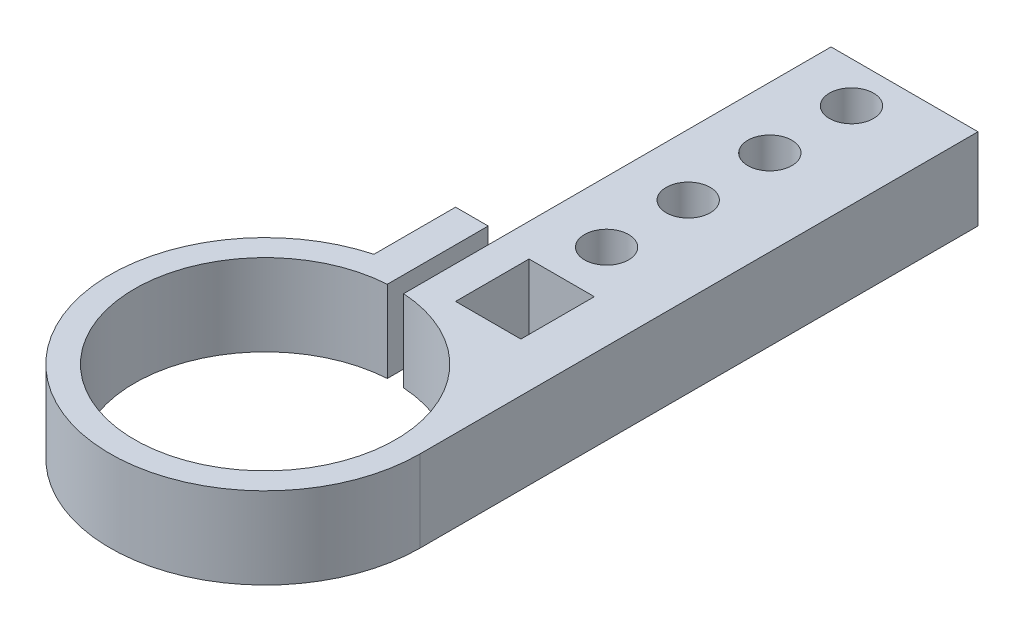
from build123d import *

# Parameters (mm, degrees)
SKETCH1_R           = 24.13
SKETCH1_R_2         = 20.32
BOSS_EXTRUDE1_DEPTH = 12.7
SKETCH2_W           = 12.7
SKETCH2_H           = 12.7
BOSS_EXTRUDE2_DEPTH = 12.7
SKETCH4_W           = 2.54
SKETCH4_H           = 58.988343485
CUT_EXTRUDE2_DEPTH  = 46.144990941
BOSS_EXTRUDE3_REACH = 68.615
BOSS_EXTRUDE3_START = 17.78
SKETCH5_W           = 35.97948453
SKETCH5_H           = 12.7
SKETCH6_W           = 22.86
SKETCH6_H           = 50.8
BOSS_EXTRUDE4_DEPTH = 12.7
SKETCH7_R           = 3.429
SKETCH7_W           = 10.16
SKETCH7_H           = 11.43
CUT_EXTRUDE3_DEPTH  = 91.9627717


with BuildPart() as part:
    # Sketch1 → Boss-Extrude1 (new body)
    with BuildSketch(Plane(origin=(0, 0, 0), x_dir=(1, 0, 0), z_dir=(0, 1, 0))):
        with Locations(Location((0, 0, 0), (0, 0, 270))):
            Circle(SKETCH1_R)
        with Locations(Location((0, 0, 0), (0, 0, 270))):
            Circle(SKETCH1_R_2, mode=Mode.SUBTRACT)
    extrude(amount=BOSS_EXTRUDE1_DEPTH)

    # Sketch2 → Boss-Extrude2 (add)
    with BuildSketch(Plane(origin=(0, 0, 0), x_dir=(1, 0, 0), z_dir=(0, 1, 0))):
        with Locations((0, 29.62948453)):
            Rectangle(SKETCH2_W, SKETCH2_H)
    extrude(amount=BOSS_EXTRUDE2_DEPTH)

    # Sketch4 → Cut-Extrude2 (cut, through all)
    with BuildSketch(Plane(origin=(0, 0, 0), x_dir=(1, 0, 0), z_dir=(0, 1, 0))):
        with Locations((0, 30.925816426)):
            Rectangle(SKETCH4_W, SKETCH4_H)
    extrude(amount=CUT_EXTRUDE2_DEPTH, mode=Mode.SUBTRACT)

    # Sketch5 → Boss-Extrude3 (add, up to next)
    with BuildSketch(Plane(origin=(6.35, 0, 0), x_dir=(0, 0, -1), z_dir=(1, 0, 0)).offset(BOSS_EXTRUDE3_START), mode=Mode.PRIVATE) as boss_extrude3_sk1:
        with Locations((17.989742265, 6.35)):
            Rectangle(SKETCH5_W, SKETCH5_H)
    boss_extrude3_tool1 = extrude(boss_extrude3_sk1.sketch, amount=-BOSS_EXTRUDE3_REACH, mode=Mode.PRIVATE) - part.part
    add(boss_extrude3_tool1.solids().sort_by_distance((24.13, 6.35, -17.989742))[0])

    # Sketch6 → Boss-Extrude4 (add)
    with BuildSketch(Plane(origin=(0, 12.7, 0), x_dir=(1, 0, 0), z_dir=(0, 1, 0))):
        with Locations((12.7, 61.37948453)):
            Rectangle(SKETCH6_W, SKETCH6_H)
    extrude(amount=-BOSS_EXTRUDE4_DEPTH)

    # Sketch7 → Cut-Extrude3 (cut, through all)
    with BuildSketch(Plane(origin=(0, 0, 0), x_dir=(1, 0, 0), z_dir=(0, 1, 0))):
        with Locations(Location((10.795, 80.42948453, 0), (0, 0, 270))):
            Circle(SKETCH7_R)
        with Locations((36.195, 80.42948453)):
            Circle(SKETCH7_R)
        with Locations((36.195, 67.72948453)):
            Circle(SKETCH7_R)
        with Locations(Location((10.795, 67.72948453, 0), (0, 0, 270))):
            Circle(SKETCH7_R)
        with Locations(Location((10.795, 55.02948453, 0), (0, 0, 270))):
            Circle(SKETCH7_R)
        with Locations((36.195, 55.02948453)):
            Circle(SKETCH7_R)
        with Locations(Location((10.795, 42.32948453, 0), (0, 0, 270))):
            Circle(SKETCH7_R)
        with Locations((36.195, 42.32948453)):
            Circle(SKETCH7_R)
        with Locations((11.43, 28.99448453)):
            Rectangle(SKETCH7_W, SKETCH7_H)
    extrude(amount=CUT_EXTRUDE3_DEPTH, mode=Mode.SUBTRACT)


solid = part.part
